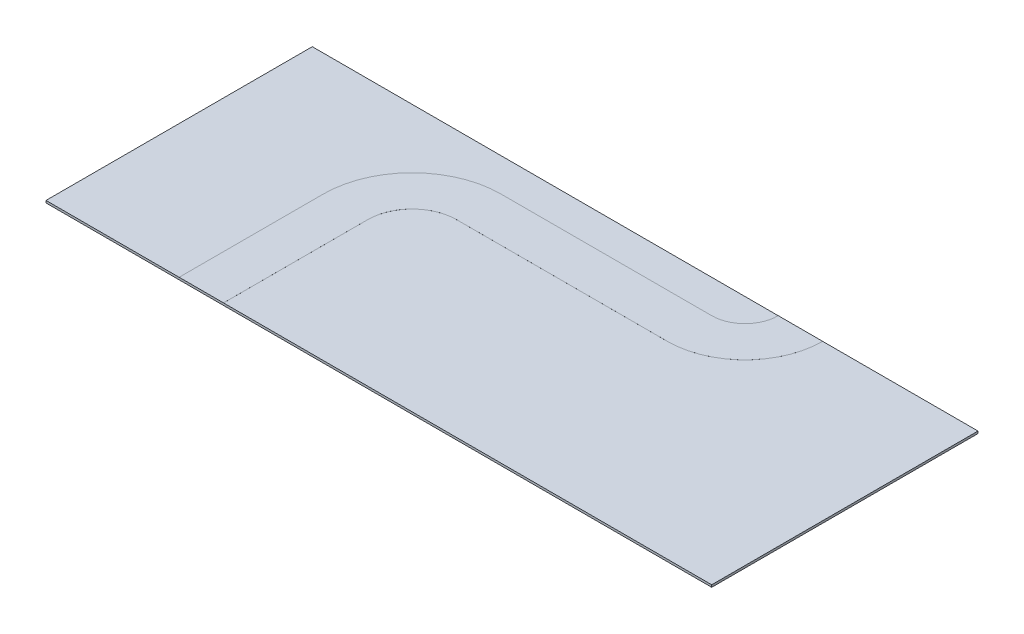
from build123d import *

# Parameters (mm, degrees)
SKIZZE1_W   = 3000
SKIZZE1_H   = 1200
BODEN_DEPTH = 10
BAHN_DEPTH  = 0.1


with BuildPart() as part:
    # Skizze1 → Boden (new body)
    with BuildSketch(Plane(origin=(0, 0, 0), x_dir=(1, 0, 0), z_dir=(0, 1, 0))):
        Rectangle(SKIZZE1_W, SKIZZE1_H)
    extrude(amount=BODEN_DEPTH)

    # Skizze2 → Bahn (add)
    with BuildSketch(Plane(origin=(0, 10, 0), x_dir=(1, 0, 0), z_dir=(0, 1, 0))):
        with BuildLine():
            Line((-700, -600), (-700, 50))
            ThreePointArc((-700, 50), (-641.421356237, 191.421356237), (-500, 250))
            Line((-500, 250), (450, 250))
            ThreePointArc((450, 250), (697.487373415, 352.512626585), (800, 600))
            Line((800, 600), (600, 600))
            ThreePointArc((600, 600), (556.066017178, 493.933982822), (450, 450))
            Line((450, 450), (-500, 450))
            ThreePointArc((-500, 450), (-782.842712475, 332.842712475), (-900, 50))
            Line((-900, 50), (-900, -600))
            Line((-900, -600), (-700, -600))
        make_face()
    extrude(amount=BAHN_DEPTH)


solid = part.part
